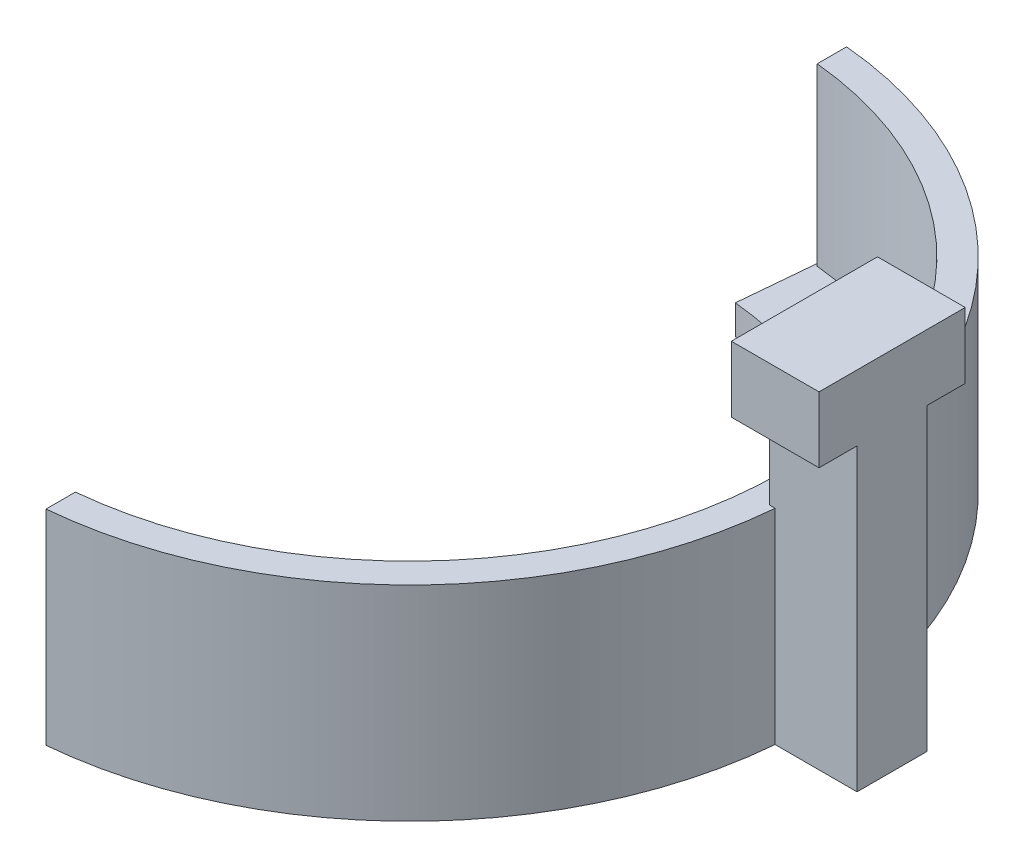
from build123d import *

# Parameters (mm, degrees)
BOSS_EXTRUDE1_DEPTH      = 12
BOSS_EXTRUDE2_START      = -2
BOSS_EXTRUDE2_DEPTH      = 2
SKETCH4_W                = 6
SKETCH4_H                = 4.8
BOSS_EXTRUDE3_DEPTH      = 22
BOSS_EXTRUDE4_DEPTH      = 3
BOSS_EXTRUDE4_DEPTH_BACK = 1.5
SKETCH5_W                = 6
SKETCH5_H                = 10


with BuildPart() as part:
    # Sketch1 → Boss-Extrude1 (new body)
    with BuildSketch(Plane(origin=(0, 0, 0), x_dir=(1, 0, 0), z_dir=(0, 1, 0))):
        with BuildLine():
            Line((2.5, 27.386127875), (2.5, 25.377155081))
            ThreePointArc((2.5, 25.377155081), (25.5, 0), (2.5, -25.377155081))
            Line((2.5, -25.377155081), (2.5, -27.386127875))
            ThreePointArc((2.5, -27.386127875), (27.5, 0), (2.5, 27.386127875))
        make_face()
    extrude(amount=BOSS_EXTRUDE1_DEPTH)

    # Sketch2 → Boss-Extrude2 (add)
    with BuildSketch(Plane(origin=(0, 0, 0), x_dir=(1, 0, 0), z_dir=(0, 1, 0)).offset(BOSS_EXTRUDE2_START)):
        with BuildLine():
            Line((2.5, 27.386127875), (1.863636364, 20.415113507))
            ThreePointArc((1.863636364, 20.415113507), (20.5, 0), (1.863636364, -20.415113507))
            Line((1.863636364, -20.415113507), (2.5, -27.386127875))
            ThreePointArc((2.5, -27.386127875), (27.5, 0), (2.5, 27.386127875))
        make_face()
    extrude(amount=BOSS_EXTRUDE2_DEPTH)

    # Sketch4 → Boss-Extrude3 (add)
    with BuildSketch(Plane(origin=(0, -2, 0), x_dir=(1, 0, 0), z_dir=(0, 1, 0))):
        with Locations((30, 0)):
            Rectangle(SKETCH4_W, SKETCH4_H)
    extrude(amount=BOSS_EXTRUDE3_DEPTH)

    # Sketch5 → Boss-Extrude4 (add, two sides: drawn at the far end of the back side and taken through both)
    with BuildSketch(Plane(origin=(0, 20, 0), x_dir=(1, 0, 0), z_dir=(0, 1, 0)).offset(-BOSS_EXTRUDE4_DEPTH_BACK)):
        with Locations((30, 0)):
            Rectangle(SKETCH5_W, SKETCH5_H)
    extrude(amount=BOSS_EXTRUDE4_DEPTH + BOSS_EXTRUDE4_DEPTH_BACK)


solid = part.part
